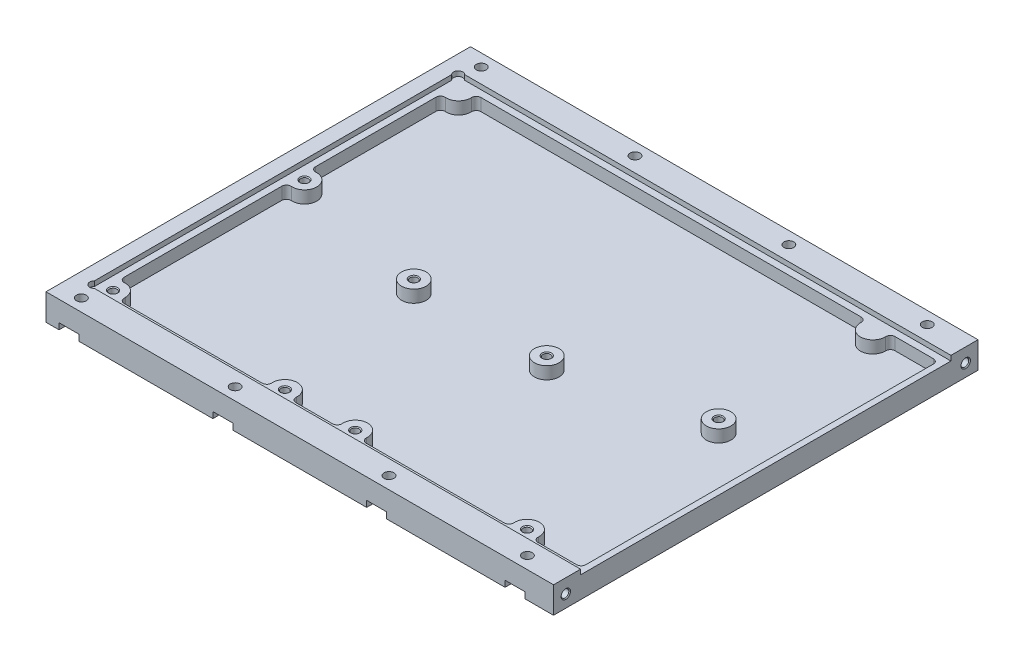
from build123d import *

# Parameters (mm, degrees)
SKETCH1_W                   = 165
SKETCH1_H                   = 138
BOSS_EXTRUDE1_DEPTH         = 7
SKETCH4_R                   = 1.25
CUT_EXTRUDE2_DEPTH          = 5
SKETCH5_R                   = 4
CUT_EXTRUDE3_DEPTH          = 4
BOSS_EXTRUDE2_DEPTH         = 1.6
CUT_EXTRUDE4_REACH          = 111.818
SKETCH7_R                   = 1.6
CUT_EXTRUDE5_DEPTH          = 2
M3_TAPPED_HOLE1_D           = 2.5
M3_TAPPED_HOLE1_DEPTH       = 7.5
M3_TAPPED_HOLE1_CSINK_D     = 3.05
M3_TAPPED_HOLE1_CSINK_ANGLE = 90
M3_TAPPED_HOLE1_TIP         = 0.751075774
M3_TAPPED_HOLE2_D           = 2.5
M3_TAPPED_HOLE2_DEPTH       = 7.5
M3_TAPPED_HOLE2_CSINK_D     = 3.05
M3_TAPPED_HOLE2_CSINK_ANGLE = 90
M3_TAPPED_HOLE2_TIP         = 0.751075774
M3_TAPPED_HOLE3_D           = 2.5
M3_TAPPED_HOLE3_DEPTH       = 5
M3_TAPPED_HOLE3_CSINK_D     = 3.05
M3_TAPPED_HOLE3_CSINK_ANGLE = 90
M3_TAPPED_HOLE3_TIP         = 0.751075774


with BuildPart() as part:
    # Sketch1 → Boss-Extrude1 (new body)
    with BuildSketch(Plane(origin=(0, 0, 0), x_dir=(1, 0, 0), z_dir=(0, 1, 0))):
        with Locations((-2.5, 0)):
            Rectangle(SKETCH1_W, SKETCH1_H)
    extrude(amount=BOSS_EXTRUDE1_DEPTH)

    # Sketch4 → Cut-Extrude2 (cut)
    with BuildSketch(Plane(origin=(0, 7, 0), x_dir=(1, 0, 0), z_dir=(0, 1, 0))):
        with Locations(Location((-76.1, -56.1, 0), (0, 0, 270))):
            Circle(SKETCH4_R)
        with Locations(Location((-20.22, -56.1, 0), (0, 0, 270))):
            Circle(SKETCH4_R)
        with Locations(Location((2.64, -56.1, 0), (0, 0, 270))):
            Circle(SKETCH4_R)
        with Locations(Location((58.49, -56.1, 0), (0, 0, 270))):
            Circle(SKETCH4_R)
        with Locations(Location((-76.1, 6.13, 0), (0, 0, 270))):
            Circle(SKETCH4_R)
        with Locations(Location((-30.38, -4.03, 0), (0, 0, 270))):
            Circle(SKETCH4_R)
        with Locations(Location((58.52, 6.16, 0), (0, 0, 270))):
            Circle(SKETCH4_R)
        with Locations(Location((12.8, -4, 0), (0, 0, 270))):
            Circle(SKETCH4_R)
    extrude(amount=-CUT_EXTRUDE2_DEPTH, mode=Mode.SUBTRACT)

    # Sketch5 → Cut-Extrude3 (cut)
    with BuildSketch(Plane(origin=(0, 7, 0), x_dir=(-1, 0, 0), z_dir=(0, -1, 0))):
        with BuildLine():
            Line((70.6, -58), (25.705435261, -58))
            ThreePointArc((25.705435261, -58), (24.606882494, -57.521362726), (24.209407462, -56.390909091))
            ThreePointArc((24.209407462, -56.390909091), (20.22, -52.1), (16.230592538, -56.390909091))
            ThreePointArc((16.230592538, -56.390909091), (15.833117506, -57.521362726), (14.734564739, -58))
            Line((14.734564739, -58), (2.845435261, -58))
            ThreePointArc((2.845435261, -58), (1.746882494, -57.521362726), (1.349407462, -56.390909091))
            ThreePointArc((1.349407462, -56.390909091), (-2.64, -52.1), (-6.629407462, -56.390909091))
            ThreePointArc((-6.629407462, -56.390909091), (-7.026882494, -57.521362726), (-8.125435261, -58))
            Line((-8.125435261, -58), (-53.004564739, -58))
            ThreePointArc((-53.004564739, -58), (-54.103117506, -57.521362726), (-54.500592538, -56.390909091))
            ThreePointArc((-54.500592538, -56.390909091), (-58.49, -52.1), (-62.479407462, -56.390909091))
            ThreePointArc((-62.479407462, -56.390909091), (-62.876882494, -57.521362726), (-63.975435261, -58))
            Line((-63.975435261, -58), (-76.5, -58))
            ThreePointArc((-76.5, -58), (-77.560660172, -57.560660172), (-78, -56.5))
            Line((-78, -56.5), (-78, 56.5))
            ThreePointArc((-78, 56.5), (-77.560660172, 57.560660172), (-76.5, 58))
            Line((-76.5, 58), (-64.015188805, 58))
            ThreePointArc((-64.015188805, 58), (-62.932578323, 57.538245898), (-62.516500949, 56.437272727))
            ThreePointArc((-62.516500949, 56.437272727), (-58.52, 52.27), (-54.523499051, 56.437272727))
            ThreePointArc((-54.523499051, 56.437272727), (-54.107421677, 57.538245898), (-53.024811195, 58))
            Line((-53.024811195, 58), (70.606148892, 58))
            ThreePointArc((70.606148892, 58), (71.691589732, 57.535286522), (72.104471921, 56.429090909))
            ThreePointArc((72.104471921, 56.429090909), (73.307865938, 53.375739645), (76.390909091, 52.250592538))
            ThreePointArc((76.390909091, 52.250592538), (77.521362726, 51.853117506), (78, 50.754564739))
            Line((78, 50.754564739), (78, 11.615435261))
            ThreePointArc((78, 11.615435261), (77.521362726, 10.516882494), (76.390909091, 10.119407462))
            ThreePointArc((76.390909091, 10.119407462), (72.1, 6.13), (76.390909091, 2.140592538))
            ThreePointArc((76.390909091, 2.140592538), (77.521362726, 1.743117506), (78, 0.644564739))
            Line((78, 0.644564739), (78, -50.6))
            ThreePointArc((78, -50.6), (77.560660172, -51.660660172), (76.5, -52.1))
            Line((76.5, -52.1), (76.1, -52.1))
            ThreePointArc((76.1, -52.1), (73.271572875, -53.271572875), (72.1, -56.1))
            Line((72.1, -56.1), (72.1, -56.5))
            ThreePointArc((72.1, -56.5), (71.660660172, -57.560660172), (70.6, -58))
        make_face()
        with Locations(Location((30.38, -4.03, 0), (0, 0, 90))):
            Circle(SKETCH5_R, mode=Mode.SUBTRACT)
        with Locations(Location((-12.8, -4, 0), (0, 0, 90))):
            Circle(SKETCH5_R, mode=Mode.SUBTRACT)
        with Locations(Location((-58.52, 6.16, 0), (0, 0, 90))):
            Circle(SKETCH5_R, mode=Mode.SUBTRACT)
    extrude(amount=CUT_EXTRUDE3_DEPTH, mode=Mode.SUBTRACT)

    # Sketch6 → Boss-Extrude2 (add)
    with BuildSketch(Plane(origin=(0, 7, 0), x_dir=(1, 0, 0), z_dir=(0, 1, 0))):
        with BuildLine():
            Line((-78.078679656, 60.2), (80, 60.2))
            Line((80, 60.2), (80, 69))
            Line((80, 69), (-85, 69))
            Line((-85, 69), (-85, -69))
            Line((-85, -69), (80, -69))
            Line((80, -69), (80, -60.2))
            Line((80, -60.2), (-78.078679656, -60.2))
            ThreePointArc((-78.078679656, -60.2), (-80.2, -60.2), (-80.2, -58.078679656))
            Line((-80.2, -58.078679656), (-80.2, 58.078679656))
            ThreePointArc((-80.2, 58.078679656), (-80.2, 60.2), (-78.078679656, 60.2))
        make_face()
    extrude(amount=BOSS_EXTRUDE2_DEPTH)

    # Sketch7 → Cut-Extrude4 (cut, up to next)
    with BuildSketch(Plane(origin=(0, 8.6, 0), x_dir=(1, 0, 0), z_dir=(0, 1, 0)), mode=Mode.PRIVATE) as cut_extrude4_sk1:
        with Locations(Location((-77.5, -65, 0), (0, 0, 270))):
            Circle(SKETCH7_R)
    cut_extrude4_tool1 = extrude(cut_extrude4_sk1.sketch, amount=-CUT_EXTRUDE4_REACH, mode=Mode.PRIVATE) & part.part
    # Sketch7 → Cut-Extrude4 (cut, up to next)
    with BuildSketch(Plane(origin=(0, 8.6, 0), x_dir=(1, 0, 0), z_dir=(0, 1, 0)), mode=Mode.PRIVATE) as cut_extrude4_sk2:
        with Locations(Location((-27.5, -65, 0), (0, 0, 270))):
            Circle(SKETCH7_R)
    cut_extrude4_tool2 = extrude(cut_extrude4_sk2.sketch, amount=-CUT_EXTRUDE4_REACH, mode=Mode.PRIVATE) & part.part
    # Sketch7 → Cut-Extrude4 (cut, up to next)
    with BuildSketch(Plane(origin=(0, 8.6, 0), x_dir=(1, 0, 0), z_dir=(0, 1, 0)), mode=Mode.PRIVATE) as cut_extrude4_sk3:
        with Locations(Location((22.5, -65, 0), (0, 0, 270))):
            Circle(SKETCH7_R)
    cut_extrude4_tool3 = extrude(cut_extrude4_sk3.sketch, amount=-CUT_EXTRUDE4_REACH, mode=Mode.PRIVATE) & part.part
    # Sketch7 → Cut-Extrude4 (cut, up to next)
    with BuildSketch(Plane(origin=(0, 8.6, 0), x_dir=(1, 0, 0), z_dir=(0, 1, 0)), mode=Mode.PRIVATE) as cut_extrude4_sk4:
        with Locations(Location((67.5, -65, 0), (0, 0, 270))):
            Circle(SKETCH7_R)
    cut_extrude4_tool4 = extrude(cut_extrude4_sk4.sketch, amount=-CUT_EXTRUDE4_REACH, mode=Mode.PRIVATE) & part.part
    # Sketch7 → Cut-Extrude4 (cut, up to next)
    with BuildSketch(Plane(origin=(0, 8.6, 0), x_dir=(1, 0, 0), z_dir=(0, 1, 0)), mode=Mode.PRIVATE) as cut_extrude4_sk5:
        with Locations(Location((-77.5, 65, 0), (0, 0, 270))):
            Circle(SKETCH7_R)
    cut_extrude4_tool5 = extrude(cut_extrude4_sk5.sketch, amount=-CUT_EXTRUDE4_REACH, mode=Mode.PRIVATE) & part.part
    # Sketch7 → Cut-Extrude4 (cut, up to next)
    with BuildSketch(Plane(origin=(0, 8.6, 0), x_dir=(1, 0, 0), z_dir=(0, 1, 0)), mode=Mode.PRIVATE) as cut_extrude4_sk6:
        with Locations(Location((-27.5, 65, 0), (0, 0, 270))):
            Circle(SKETCH7_R)
    cut_extrude4_tool6 = extrude(cut_extrude4_sk6.sketch, amount=-CUT_EXTRUDE4_REACH, mode=Mode.PRIVATE) & part.part
    # Sketch7 → Cut-Extrude4 (cut, up to next)
    with BuildSketch(Plane(origin=(0, 8.6, 0), x_dir=(1, 0, 0), z_dir=(0, 1, 0)), mode=Mode.PRIVATE) as cut_extrude4_sk7:
        with Locations(Location((22.5, 65, 0), (0, 0, 270))):
            Circle(SKETCH7_R)
    cut_extrude4_tool7 = extrude(cut_extrude4_sk7.sketch, amount=-CUT_EXTRUDE4_REACH, mode=Mode.PRIVATE) & part.part
    # Sketch7 → Cut-Extrude4 (cut, up to next)
    with BuildSketch(Plane(origin=(0, 8.6, 0), x_dir=(1, 0, 0), z_dir=(0, 1, 0)), mode=Mode.PRIVATE) as cut_extrude4_sk8:
        with Locations(Location((67.5, 65, 0), (0, 0, 270))):
            Circle(SKETCH7_R)
    cut_extrude4_tool8 = extrude(cut_extrude4_sk8.sketch, amount=-CUT_EXTRUDE4_REACH, mode=Mode.PRIVATE) & part.part
    add(cut_extrude4_tool1.solids().sort_by_distance((-77.5, 8.6, 65))[0], mode=Mode.SUBTRACT)
    add(cut_extrude4_tool2.solids().sort_by_distance((-27.5, 8.6, 65))[0], mode=Mode.SUBTRACT)
    add(cut_extrude4_tool3.solids().sort_by_distance((22.5, 8.6, 65))[0], mode=Mode.SUBTRACT)
    add(cut_extrude4_tool4.solids().sort_by_distance((67.5, 8.6, 65))[0], mode=Mode.SUBTRACT)
    add(cut_extrude4_tool5.solids().sort_by_distance((-77.5, 8.6, -65))[0], mode=Mode.SUBTRACT)
    add(cut_extrude4_tool6.solids().sort_by_distance((-27.5, 8.6, -65))[0], mode=Mode.SUBTRACT)
    add(cut_extrude4_tool7.solids().sort_by_distance((22.5, 8.6, -65))[0], mode=Mode.SUBTRACT)
    add(cut_extrude4_tool8.solids().sort_by_distance((67.5, 8.6, -65))[0], mode=Mode.SUBTRACT)

    # Sketch8 → Cut-Extrude5 (cut)
    with BuildSketch(Plane(origin=(0, 0, 0), x_dir=(-1, 0, 0), z_dir=(0, -1, 0))):
        with BuildLine():
            Line((-70.75, -65), (-70.75, -69))
            Line((-70.75, -69), (-64.25, -69))
            Line((-64.25, -69), (-64.25, -65))
            ThreePointArc((-64.25, -65), (-67.5, -61.75), (-70.75, -65))
        make_face()
        with BuildLine():
            Line((-25.75, -65), (-25.75, -69))
            Line((-25.75, -69), (-19.25, -69))
            Line((-19.25, -69), (-19.25, -65))
            ThreePointArc((-19.25, -65), (-22.5, -61.75), (-25.75, -65))
        make_face()
        with BuildLine():
            Line((24.25, -65), (24.25, -69))
            Line((24.25, -69), (30.75, -69))
            Line((30.75, -69), (30.75, -65))
            ThreePointArc((30.75, -65), (27.5, -61.75), (24.25, -65))
        make_face()
        with BuildLine():
            Line((74.25, -65), (74.25, -69))
            Line((74.25, -69), (80.75, -69))
            Line((80.75, -69), (80.75, -65))
            ThreePointArc((80.75, -65), (77.5, -61.75), (74.25, -65))
        make_face()
        with BuildLine():
            Line((80.75, 65), (80.75, 69))
            Line((80.75, 69), (74.25, 69))
            Line((74.25, 69), (74.25, 65))
            ThreePointArc((74.25, 65), (77.5, 61.75), (80.75, 65))
        make_face()
        with BuildLine():
            Line((30.75, 65), (30.75, 69))
            Line((30.75, 69), (24.25, 69))
            Line((24.25, 69), (24.25, 65))
            ThreePointArc((24.25, 65), (27.5, 61.75), (30.75, 65))
        make_face()
        with BuildLine():
            Line((-19.25, 65), (-19.25, 69))
            Line((-19.25, 69), (-25.75, 69))
            Line((-25.75, 69), (-25.75, 65))
            ThreePointArc((-25.75, 65), (-22.5, 61.75), (-19.25, 65))
        make_face()
        with BuildLine():
            Line((-64.25, 65), (-64.25, 69))
            Line((-64.25, 69), (-70.75, 69))
            Line((-70.75, 69), (-70.75, 65))
            ThreePointArc((-70.75, 65), (-67.5, 61.75), (-64.25, 65))
        make_face()
    extrude(amount=-CUT_EXTRUDE5_DEPTH, mode=Mode.SUBTRACT)

    # M3 Tapped Hole1
    with Locations(Plane(origin=(0, 0, 0), x_dir=(-1, 0, 0), z_dir=(0, -1, 0))):
        with Locations((70, -64.6), (2.5, -64.6), (-60, -64.6), (2.5, 64.6), (70, 64.6), (-60, 64.6)):
            CounterSinkHole(M3_TAPPED_HOLE1_D / 2, M3_TAPPED_HOLE1_CSINK_D / 2, depth=M3_TAPPED_HOLE1_DEPTH, counter_sink_angle=M3_TAPPED_HOLE1_CSINK_ANGLE)
            with Locations((0, 0, -(M3_TAPPED_HOLE1_DEPTH + M3_TAPPED_HOLE1_TIP / 2))):  # 118° drill point
                Cone(0, M3_TAPPED_HOLE1_D / 2, M3_TAPPED_HOLE1_TIP, mode=Mode.SUBTRACT)

    # M3 Tapped Hole2
    with Locations(Plane(origin=(80, 0, 0), x_dir=(0, 0, -1), z_dir=(1, 0, 0))):
        with Locations((-65, 4), (65, 4)):
            CounterSinkHole(M3_TAPPED_HOLE2_D / 2, M3_TAPPED_HOLE2_CSINK_D / 2, depth=M3_TAPPED_HOLE2_DEPTH, counter_sink_angle=M3_TAPPED_HOLE2_CSINK_ANGLE)
            with Locations((0, 0, -(M3_TAPPED_HOLE2_DEPTH + M3_TAPPED_HOLE2_TIP / 2))):  # 118° drill point
                Cone(0, M3_TAPPED_HOLE2_D / 2, M3_TAPPED_HOLE2_TIP, mode=Mode.SUBTRACT)

    # M3 Tapped Hole3
    with Locations(Plane(origin=(0, 7, 0), x_dir=(1, 0, 0), z_dir=(0, 1, 0))):
        with Locations((-76.1, 6.13), (-30.38, -4.03), (12.8, -4), (58.52, 6.16), (-76.1, -56.1), (-20.22, -56.1), (2.64, -56.1), (58.49, -56.1)):
            CounterSinkHole(M3_TAPPED_HOLE3_D / 2, M3_TAPPED_HOLE3_CSINK_D / 2, depth=M3_TAPPED_HOLE3_DEPTH, counter_sink_angle=M3_TAPPED_HOLE3_CSINK_ANGLE)
            with Locations((0, 0, -(M3_TAPPED_HOLE3_DEPTH + M3_TAPPED_HOLE3_TIP / 2))):  # 118° drill point
                Cone(0, M3_TAPPED_HOLE3_D / 2, M3_TAPPED_HOLE3_TIP, mode=Mode.SUBTRACT)


solid = part.part
